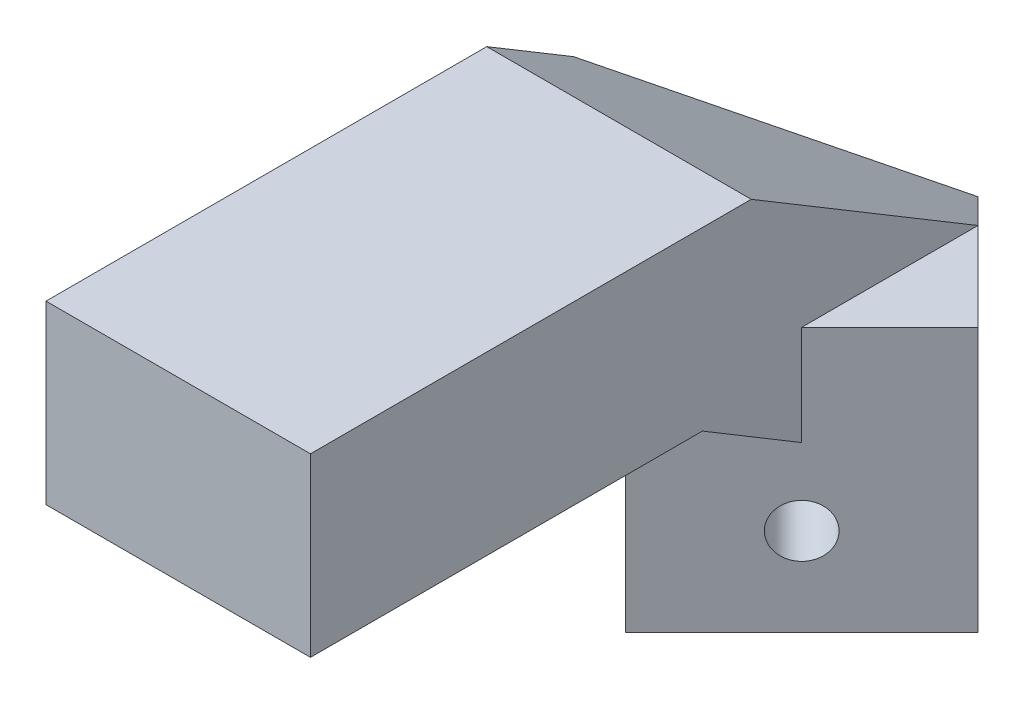
from build123d import *

# Parameters (mm, degrees)
SALIENTE_EXTRUIR2_DEPTH    = 30
CROQUIS3_W                 = 60.629420227
CROQUIS3_H                 = 60.965705304
CORTAR_EXTRUIR1_DEPTH      = 30
CROQUIS4_R                 = 3
CORTAR_EXTRUIR2_DEPTH      = 88.482529848
CROQUIS5_W                 = 28.284271248
CROQUIS5_H                 = 30
SALIENTE_EXTRUIR3_DEPTH    = 14.142136
SALIENTE_EXTRUIR4_DEPTH    = 10
CROQUIS7_W                 = 23.581736244
CROQUIS7_H                 = 30.206171788
CORTAR_EXTRUIR3_DEPTH      = 60
CROQUIS8_R                 = 3
CORTAR_EXTRUIR4_DEPTH      = 99.7393004
CROQUIS10_W                = 79.072347139
CROQUIS10_H                = 56.401254602
CORTAR_EXTRUIR5_DEPTH      = 50
CORTAR_EXTRUIR6_DEPTH      = 66
CORTAR_EXTRUIR6_DEPTH_BACK = 97
CROQUIS11_W                = 135.934764717
CROQUIS11_H                = 98.230231438


with BuildPart() as part:
    # Croquis2 → Saliente-Extruir2 (new body)
    with BuildSketch(Plane(origin=(0, 0, 0), x_dir=(0, 0, -1), z_dir=(1, 0, 0))):
        Polygon((0, 0), (-50, 0), (-75.724787771, -15.434872663), (-75.724787771, -45.434872663), (-55.724787771, -45.434872663), (-55.724787771, -26.758680242), (-44.460320701, -20), (0, -20), align=None)
    extrude(amount=SALIENTE_EXTRUIR2_DEPTH)

    # Croquis3 → Cortar-Extruir1 (cut)
    with BuildSketch(Plane(origin=(-22.862393886, 0, 22.862393886), x_dir=(0.7071067811865462, 0, 0.7071067811865488), z_dir=(-0.7071067811865488, 0, 0.7071067811865462))):
        with Locations((51.516510193, -19.86952732)):
            Rectangle(CROQUIS3_W, CROQUIS3_H)
    extrude(amount=CORTAR_EXTRUIR1_DEPTH, mode=Mode.SUBTRACT)

    # Croquis4 → Cortar-Extruir2 (cut, through all)
    with BuildSketch(Plane(origin=(-22.862393886, 0, 22.862393886), x_dir=(0.7071067811865461, 0, 0.7071067811865489), z_dir=(-0.7071067811865489, 0, 0.7071067811865461))):
        with Locations((60.616578749, -34.226076292)):
            Circle(CROQUIS4_R)
    extrude(amount=-CORTAR_EXTRUIR2_DEPTH, mode=Mode.SUBTRACT)

    # Croquis5 → Saliente-Extruir3 (add)
    with BuildSketch(Plane(origin=(-22.862393886, 0, 22.862393886), x_dir=(0.7071067811865461, 0, 0.7071067811865489), z_dir=(-0.7071067811865489, 0, 0.7071067811865461))):
        with Locations((60.616578749, -30.434872663)):
            Rectangle(CROQUIS5_W, CROQUIS5_H)
    extrude(amount=-SALIENTE_EXTRUIR3_DEPTH)

    # Croquis6 → Saliente-Extruir4 (add)
    with BuildSketch(Plane(origin=(-22.862393886, 0, 22.862393886), x_dir=(0.7071067811865461, 0, 0.7071067811865489), z_dir=(-0.7071067811865489, 0, 0.7071067811865461))):
        Polygon((32.332307501, -20.758680242), (46.474443125, -26.758680242), (46.474443125, -45.434872663), (74.758714373, -45.434872663), (74.758714373, -15.434872663), (38.378370617, 0), (32.332307501, 0), align=None)
    extrude(amount=SALIENTE_EXTRUIR4_DEPTH)

    # Croquis7 → Cortar-Extruir3 (cut)
    with BuildSketch(Plane(origin=(0, 0, 0), x_dir=(1, 0, 0), z_dir=(0, 1, 0))):
        with Locations((-11.790868122, -58.05803285)):
            Rectangle(CROQUIS7_W, CROQUIS7_H)
    extrude(amount=-CORTAR_EXTRUIR3_DEPTH, mode=Mode.SUBTRACT)

    # Croquis8 → Cortar-Extruir4 (cut, through all)
    with BuildSketch(Plane(origin=(-29.933461698, 0, 29.933461698), x_dir=(0.707106781186546, 0, 0.7071067811865491), z_dir=(-0.7071067811865491, 0, 0.707106781186546))):
        with Locations((60.616578749, -35.434872663)):
            Circle(CROQUIS8_R)
    extrude(amount=-CORTAR_EXTRUIR4_DEPTH, mode=Mode.SUBTRACT)

    # Croquis10 → Cortar-Extruir5 (cut)
    with BuildSketch(Plane(origin=(0, 22.058823529, 13.235294118), x_dir=(1, 0, 0), z_dir=(0, 0.8574929257125444, 0.5144957554275262))):
        with Locations((7.523719949, -68.590647859)):
            Rectangle(CROQUIS10_W, CROQUIS10_H)
    extrude(amount=CORTAR_EXTRUIR5_DEPTH, mode=Mode.SUBTRACT)


with BuildPart() as body_2:
    # Simetría3: mirrored copy
    add(part.part.mirror(Plane(origin=(0, 0, -5), x_dir=(1, 0, 0), z_dir=(0, 0, -1))))


with BuildPart() as part_1:
    add(part.part)

    # Croquis11 → Cortar-Extruir6 (cut, two sides: drawn at the far end of the back side and taken through both)
    with BuildSketch(Plane.XZ.offset(20).offset(-CORTAR_EXTRUIR6_DEPTH_BACK)):
        with Locations((20.973016289, 43.122891159)):
            Rectangle(CROQUIS11_W, CROQUIS11_H)
    extrude(amount=CORTAR_EXTRUIR6_DEPTH + CORTAR_EXTRUIR6_DEPTH_BACK, mode=Mode.SUBTRACT)


solid = body_2.part
